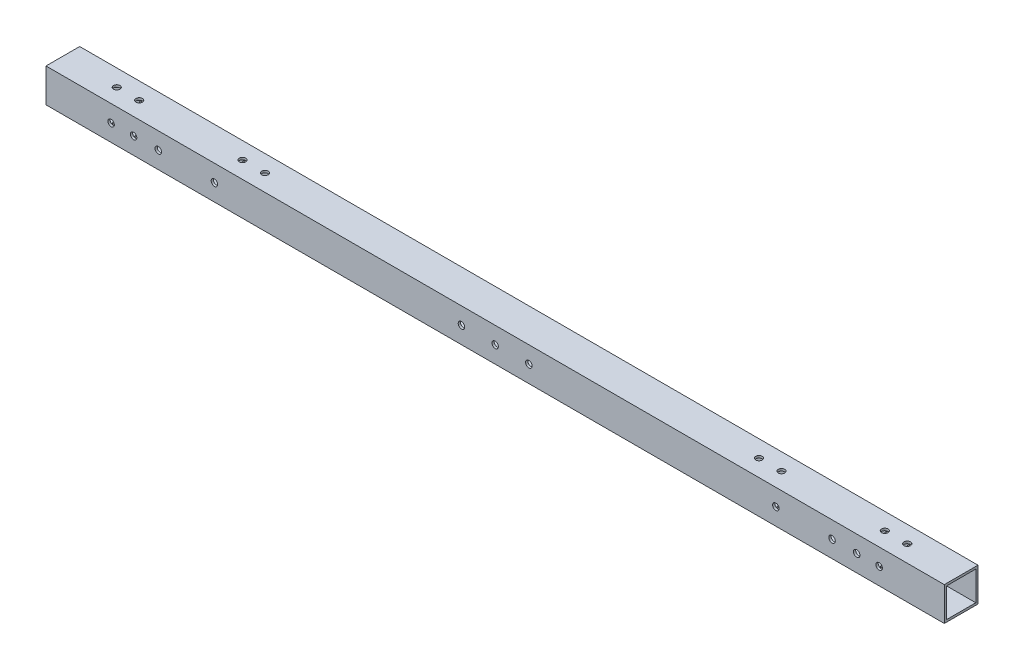
from build123d import *

# Parameters (mm, degrees)
SKETCH_1_W          = 15
SKETCH_1_H          = 15
SKETCH_1_W_2        = 13
SKETCH_1_H_2        = 13
EXTRUDE_1_DEPTH     = 400
SKETCH_2_R          = 1.45
CUT_EXTRUDE_1_DEPTH = 401.35140814
SKETCH_3_R          = 1.45
CUT_EXTRUDE_2_DEPTH = 401.35140814


with BuildPart() as part:
    # 草图1 → 凸台-拉伸1 (new body)
    with BuildSketch(Plane(origin=(0, 0, 0), x_dir=(0, 0, -1), z_dir=(1, 0, 0))):
        Rectangle(SKETCH_1_W, SKETCH_1_H)
        Rectangle(SKETCH_1_W_2, SKETCH_1_H_2, mode=Mode.SUBTRACT)
    extrude(amount=EXTRUDE_1_DEPTH)

    # 草图2 → 切除-拉伸1 (cut, through all)
    with BuildSketch(Plane.XY.offset(7.5)):
        with Locations((371, 0)):
            Circle(SKETCH_2_R)
        with Locations((361, 0)):
            Circle(SKETCH_2_R)
        with Locations((350, 0)):
            Circle(SKETCH_2_R)
        with Locations((325, 0)):
            Circle(SKETCH_2_R)
        with Locations((215, 0)):
            Circle(SKETCH_2_R)
        with Locations((200, 0)):
            Circle(SKETCH_2_R)
        with Locations((185, 0)):
            Circle(SKETCH_2_R)
        with Locations((75, 0)):
            Circle(SKETCH_2_R)
        with Locations((50, 0)):
            Circle(SKETCH_2_R)
        with Locations((39, 0)):
            Circle(SKETCH_2_R)
        with Locations((29, 0)):
            Circle(SKETCH_2_R)
    extrude(amount=-CUT_EXTRUDE_1_DEPTH, mode=Mode.SUBTRACT)

    # 草图3 → 切除-拉伸2 (cut, through all)
    with BuildSketch(Plane(origin=(0, 7.5, 0), x_dir=(1, 0, 0), z_dir=(0, 1, 0))):
        with Locations(Location((376, 0, 0), (0, 0, 270))):
            Circle(SKETCH_3_R)
        with Locations(Location((366, 0, 0), (0, 0, 270))):
            Circle(SKETCH_3_R)
        with Locations(Location((320, 0, 0), (0, 0, 270))):
            Circle(SKETCH_3_R)
        with Locations(Location((310, 0, 0), (0, 0, 270))):
            Circle(SKETCH_3_R)
        with Locations(Location((90, 0, 0), (0, 0, 270))):
            Circle(SKETCH_3_R)
        with Locations(Location((80, 0, 0), (0, 0, 270))):
            Circle(SKETCH_3_R)
        with Locations(Location((34, 0, 0), (0, 0, 270))):
            Circle(SKETCH_3_R)
        with Locations(Location((24, 0, 0), (0, 0, 270))):
            Circle(SKETCH_3_R)
    extrude(amount=-CUT_EXTRUDE_2_DEPTH, mode=Mode.SUBTRACT)


solid = part.part
